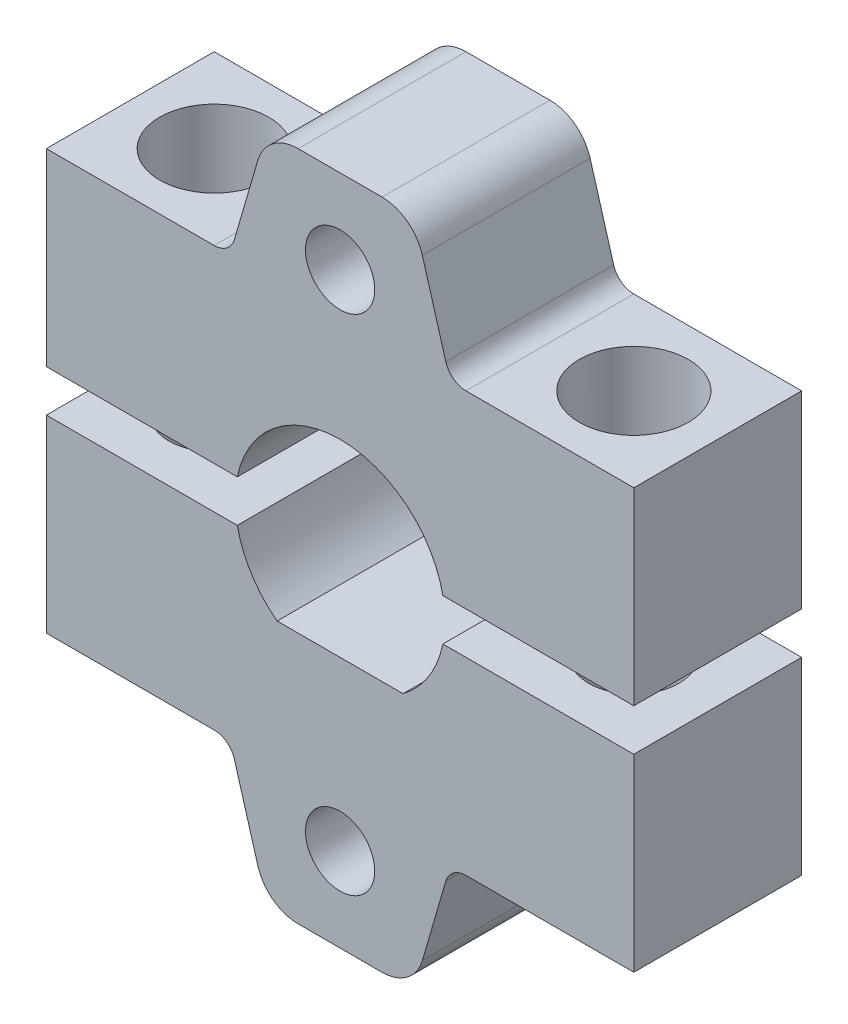
from build123d import *

# Parameters (mm, degrees)
SKETCH_1_R               = 1.65
EXTRUDE_1_DEPTH          = 8
EXTRUDE_1_2_DEPTH        = 8
CUT_EXTRUDE_2_DEPTH      = 31.594117082
CUT_EXTRUDE_2_DEPTH_BACK = 9
SKETCH_3_R               = 2.6
SKETCH_4_R               = 2.15
CUT_EXTRUDE_3_DEPTH      = 31.594117082


with BuildPart() as part:
    # 草图1 → 凸台-拉伸1 (new body)
    with BuildSketch(Plane.XY):
        with BuildLine():
            Line((-3, -4), (3, -4))
            ThreePointArc((3, -4), (4.224744871, -2.674234614), (4.898979486, -1))
            Line((4.898979486, -1), (14, -1))
            Line((14, -1), (14, -10))
            Line((14, -10), (6, -10))
            ThreePointArc((6, -10), (5.4, -10.2), (5.04, -10.72))
            Line((5.04, -10.72), (3.92, -14.56))
            ThreePointArc((3.92, -14.56), (3.2, -15.6), (2, -16))
            Line((2, -16), (-2, -16))
            ThreePointArc((-2, -16), (-3.2, -15.6), (-3.92, -14.56))
            Line((-3.92, -14.56), (-5.04, -10.72))
            ThreePointArc((-5.04, -10.72), (-5.4, -10.2), (-6, -10))
            Line((-6, -10), (-14, -10))
            Line((-14, -10), (-14, -1))
            Line((-14, -1), (-4.898979486, -1))
            ThreePointArc((-4.898979486, -1), (-4.224744871, -2.674234614), (-3, -4))
        make_face()
        with Locations((0, -12)):
            Circle(SKETCH_1_R, mode=Mode.SUBTRACT)
    extrude(amount=EXTRUDE_1_DEPTH)

    # 草图4 → 切除-拉伸3 (cut, through all)
    with BuildSketch(Plane(origin=(0, -10, 0), x_dir=(1, 0, 0), z_dir=(0, 1, 0))):
        with Locations((10, -4)):
            Circle(SKETCH_4_R)
        with Locations((-10, -4)):
            Circle(SKETCH_4_R)
    extrude(amount=CUT_EXTRUDE_3_DEPTH, mode=Mode.SUBTRACT)


with BuildPart() as body_2:
    # 草图1 → Extrude 1 2 (new body)
    with BuildSketch(Plane.XY):
        with BuildLine():
            Line((-3.92, 14.56), (-5.04, 10.72))
            ThreePointArc((-5.04, 10.72), (-5.4, 10.2), (-6, 10))
            Line((-6, 10), (-14, 10))
            Line((-14, 10), (-14, 1))
            Line((-14, 1), (-4.898979486, 1))
            ThreePointArc((-4.898979486, 1), (0, 5), (4.898979486, 1))
            Line((4.898979486, 1), (14, 1))
            Line((14, 1), (14, 10))
            Line((14, 10), (6, 10))
            ThreePointArc((6, 10), (5.4, 10.2), (5.04, 10.72))
            Line((5.04, 10.72), (3.92, 14.56))
            ThreePointArc((3.92, 14.56), (3.2, 15.6), (2, 16))
            Line((2, 16), (-2, 16))
            ThreePointArc((-2, 16), (-3.2, 15.6), (-3.92, 14.56))
        make_face()
        with Locations((0, 12)):
            Circle(SKETCH_1_R, mode=Mode.SUBTRACT)
    extrude(amount=EXTRUDE_1_2_DEPTH)

    # 草图3 → 切除-拉伸2 (cut, two sides: drawn at the far end of the back side and taken through both)
    with BuildSketch(Plane(origin=(0, 10, 0), x_dir=(1, 0, 0), z_dir=(0, 1, 0)).offset(-CUT_EXTRUDE_2_DEPTH_BACK)):
        with Locations(Location((10, -4, 0), (0, 0, 180))):
            Circle(SKETCH_3_R)
        with Locations(Location((-10, -4, 0), (0, 0, 90))):
            Circle(SKETCH_3_R)
    extrude(amount=CUT_EXTRUDE_2_DEPTH + CUT_EXTRUDE_2_DEPTH_BACK, mode=Mode.SUBTRACT)


solid = Compound([part.part, body_2.part])
